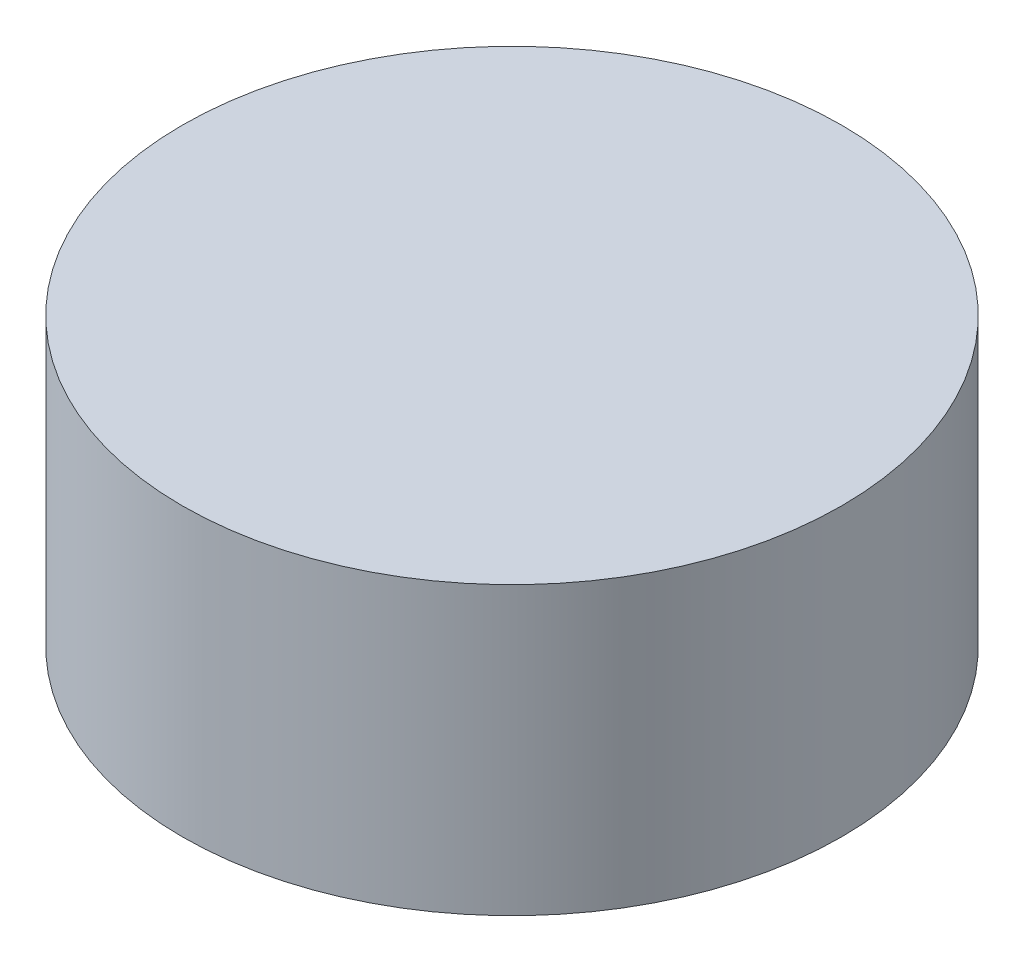
from build123d import *

# Parameters (mm, degrees)
SKETCH_1_R      = 46
EXTRUDE_1_DEPTH = 40


with BuildPart() as part:
    # 草图1 → 凸台-拉伸1 (new body)
    with BuildSketch(Plane(origin=(0, 0, 0), x_dir=(1, 0, 0), z_dir=(0, 1, 0))):
        with Locations(Location((0, 0, 0), (0, 0, 270))):
            Circle(SKETCH_1_R)
    extrude(amount=EXTRUDE_1_DEPTH)


solid = part.part
